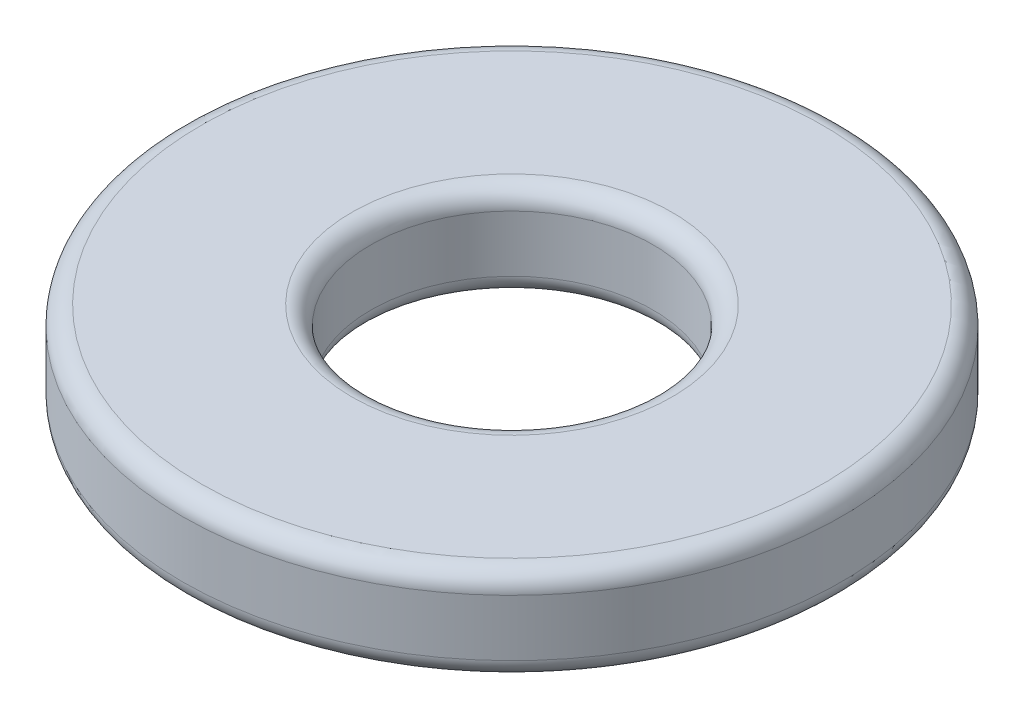
from build123d import *

# Parameters (mm, degrees)
SKETCH1_R           = 3.5
SKETCH1_R_2         = 1.5
BOSS_EXTRUDE1_DEPTH = 1
FILLET1_R           = 0.2


with BuildPart() as part:
    # Sketch1 → Boss-Extrude1 (new body)
    with BuildSketch(Plane(origin=(0, 0, 0), x_dir=(1, 0, 0), z_dir=(0, 1, 0))):
        with Locations(Location((0, 0, 0), (0, 0, 270))):
            Circle(SKETCH1_R)
        with Locations(Location((0, 0, 0), (0, 0, 270))):
            Circle(SKETCH1_R_2, mode=Mode.SUBTRACT)
    extrude(amount=BOSS_EXTRUDE1_DEPTH)

    # Fillet1
    fillet1_edges = [part.edges().sort_by_distance(p)[0] for p in [
        (0, 0, -3.5),
        (0, 1, -3.5),
        (0, 0, -1.5),
        (0, 1, -1.5),
    ]]
    fillet(fillet1_edges, radius=FILLET1_R)


solid = part.part
